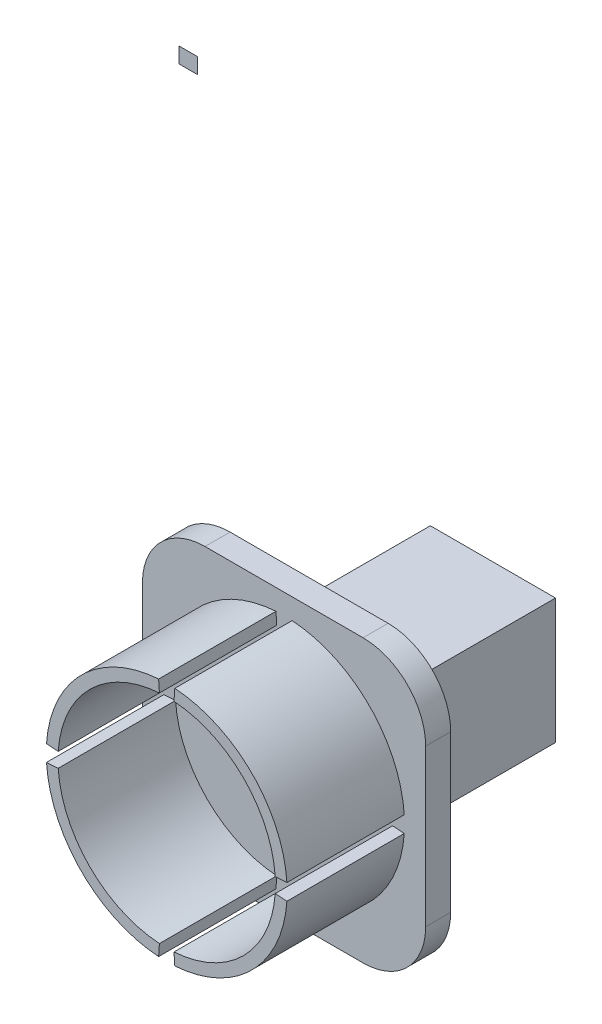
from build123d import *

# Parameters (mm, degrees)
SKETCH1_W           = 1.158652837
SKETCH1_H           = 0.996663238
BOSS_EXTRUDE1_DEPTH = 0.0005
SKETCH2_W           = 8
SKETCH2_H           = 8
BOSS_EXTRUDE2_DEPTH = 11.74993
BOSS_EXTRUDE3_DEPTH = 1.6
SKETCH4_R           = 7.7
BOSS_EXTRUDE4_DEPTH = 7.5
SKETCH5_R           = 6.95
CUT_EXTRUDE1_DEPTH  = 7.5
CUT_EXTRUDE2_DEPTH  = 7.5
CIRPATTERN1_COUNT   = 4


with BuildPart() as part:
    # Sketch1 → Boss-Extrude1 (new body)
    with BuildSketch(Plane.XY):
        with Locations((-19.474752995, 22.028941101)):
            Rectangle(SKETCH1_W, SKETCH1_H)
    extrude(amount=BOSS_EXTRUDE1_DEPTH)


with BuildPart() as body_2:
    # Sketch2 → Boss-Extrude2 (new body)
    with BuildSketch(Plane.XY):
        Rectangle(SKETCH2_W, SKETCH2_H)
        with BuildLine():
            Line((-2.579374981, 1.43), (2.579374981, 1.43))
            ThreePointArc((2.579374981, 1.43), (2.949249821, 0.000883851), (2.580231621, -1.428453735))
            Line((2.580231621, -1.428453735), (-2.578517414, -1.431545751))
            ThreePointArc((-2.578517414, -1.431545751), (-2.949249821, -0.000883851), (-2.579374981, 1.43))
        make_face(mode=Mode.SUBTRACT)
    extrude(amount=BOSS_EXTRUDE2_DEPTH)

    # Sketch3 → Boss-Extrude3 (add)
    with BuildSketch(Plane.XY.offset(11.74993)):
        with BuildLine():
            Line((-5.05, 9.000108401), (5.05, 9.000108401))
            ThreePointArc((5.05, 9.000108401), (7.878427125, 7.828535526), (9.05, 5.000108401))
            Line((9.05, 5.000108401), (9.05, -5.000108401))
            ThreePointArc((9.05, -5.000108401), (7.878427125, -7.828535526), (5.05, -9.000108401))
            Line((5.05, -9.000108401), (-5.05, -9.000108401))
            ThreePointArc((-5.05, -9.000108401), (-7.878427125, -7.828535526), (-9.05, -5.000108401))
            Line((-9.05, -5.000108401), (-9.05, 5.000108401))
            ThreePointArc((-9.05, 5.000108401), (-7.878427125, 7.828535526), (-5.05, 9.000108401))
        make_face()
    extrude(amount=BOSS_EXTRUDE3_DEPTH)

    # Sketch4 → Boss-Extrude4 (add)
    with BuildSketch(Plane.XY.offset(13.34993)):
        Circle(SKETCH4_R)
    extrude(amount=BOSS_EXTRUDE4_DEPTH)

    # Sketch5 → Cut-Extrude1 (cut)
    with BuildSketch(Plane.XY.offset(13.34993)):
        Circle(SKETCH5_R)
    extrude(amount=CUT_EXTRUDE1_DEPTH, mode=Mode.SUBTRACT)

    # Sketch11 → Cut-Extrude2 (cut)
    with BuildSketch(Plane.XY.offset(13.34993)):
        Polygon((0, 8.183776361), (-0.55, 8.183776361), (0, 0), (0.55, 8.183776361), align=None)
    cut_extrude2 = extrude(amount=CUT_EXTRUDE2_DEPTH, mode=Mode.SUBTRACT)

    # CirPattern1: Cut-Extrude2 ×4 about axis
    cirpattern1_axis = Axis((0, 0, 20.84993), (0, 0, -1))
    for i in range(1, CIRPATTERN1_COUNT):
        add(cut_extrude2.rotate(cirpattern1_axis, i * 360 / CIRPATTERN1_COUNT), mode=Mode.SUBTRACT)


solid = Compound([part.part, body_2.part])
